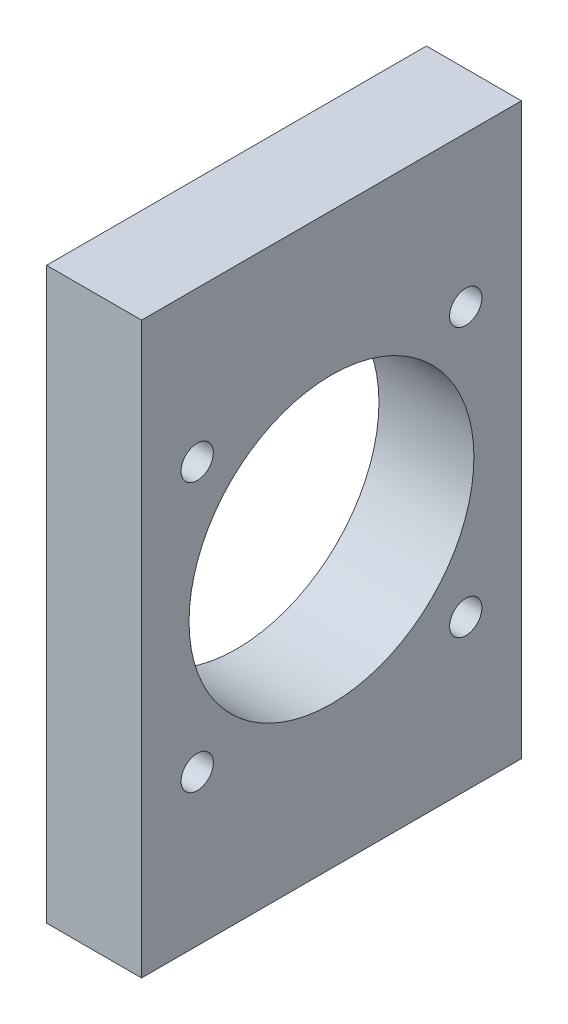
from build123d import *

# Parameters (mm, degrees)
SKETCH1_W                                            = 40
SKETCH1_H                                            = 60
BOSS_EXTRUDE1_DEPTH                                  = 10
CBORE_FOR_M3_HEX_SOCKET_THIN_HEAD_CAP_SC_D           = 3.4
CBORE_FOR_M3_HEX_SOCKET_THIN_HEAD_CAP_SC_CBORE_D     = 6.5
CBORE_FOR_M3_HEX_SOCKET_THIN_HEAD_CAP_SC_CBORE_DEPTH = 2.4
SKETCH4_R                                            = 15
CUT_EXTRUDE1_DEPTH                                   = 73.801098893


with BuildPart() as part:
    # Sketch1 → Boss-Extrude1 (new body)
    with BuildSketch(Plane(origin=(0, 0, 0), x_dir=(0, 0, -1), z_dir=(1, 0, 0))):
        with Locations((20, 30)):
            Rectangle(SKETCH1_W, SKETCH1_H)
    extrude(amount=BOSS_EXTRUDE1_DEPTH)

    # CBORE for M3 Hex Socket Thin Head Cap Screw1 (through all)
    with Locations(Plane(origin=(0, 0, 0), x_dir=(0, 0, -1), z_dir=(-1, 0, 0))):
        with Locations((5.857864376, -15.857864376), (5.857864376, -44.142135624), (34.142135624, -44.142135624), (34.142135624, -15.857864376)):
            CounterBoreHole(CBORE_FOR_M3_HEX_SOCKET_THIN_HEAD_CAP_SC_D / 2, CBORE_FOR_M3_HEX_SOCKET_THIN_HEAD_CAP_SC_CBORE_D / 2, CBORE_FOR_M3_HEX_SOCKET_THIN_HEAD_CAP_SC_CBORE_DEPTH)

    # Sketch4 → Cut-Extrude1 (cut, through all)
    with BuildSketch(Plane.ZY):
        with Locations((-20, 30)):
            Circle(SKETCH4_R)
    extrude(amount=-CUT_EXTRUDE1_DEPTH, mode=Mode.SUBTRACT)


solid = part.part
